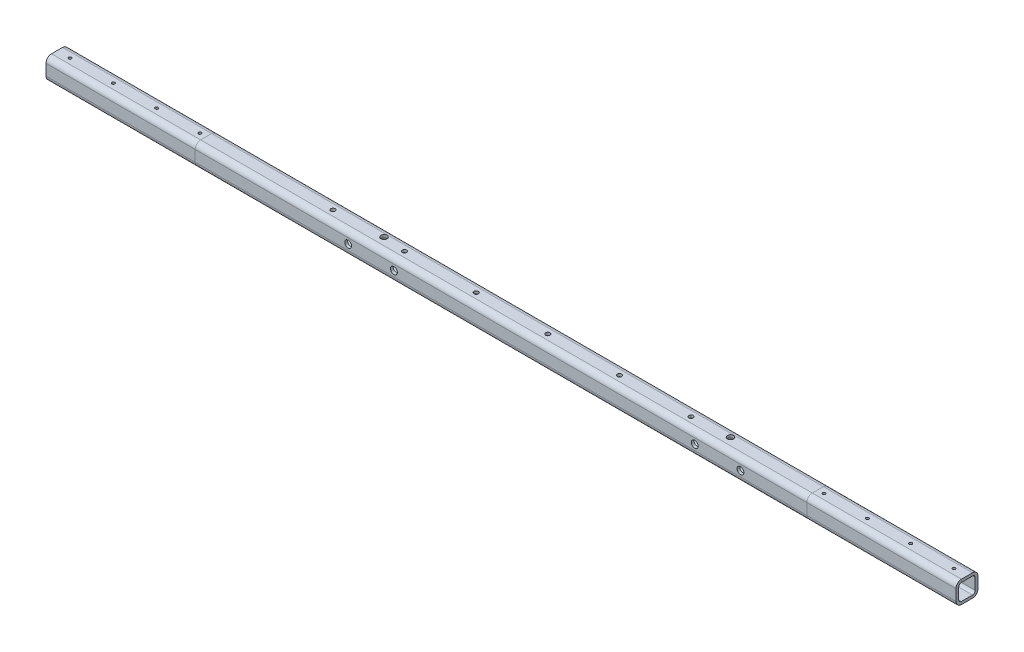
from build123d import *

# Parameters (mm, degrees)
MIEMBRO_ESTRUCTURAL1_DEPTH             = 1412
TALADRO_DE_MARGEN_PARA_M61_D           = 6.6
TALADRO_DE_MARGEN_PARA_M61_DEPTH       = 6.35
TALADRO_DE_MARGEN_PARA_3_81_D          = 10.0838
TALADRO_DE_MARGEN_PARA_3_81_DEPTH      = 6.35
MIEMBRO_ESTRUCTURAL2_DEPTH             = 344.4
MIEMBRO_ESTRUCTURAL2_2_DEPTH           = 344.4
CROQUIS9_W                             = 3.3782
CROQUIS9_H                             = 6.35
TALADRO_DE_MARGEN_PARA_1_41_AT_2_COUNT = 2
TALADRO_DE_MARGEN_PARA_1_41_AT_2_PITCH = 45
TALADRO_DE_MARGEN_PARA_1_41_AT_3_COUNT = 2
TALADRO_DE_MARGEN_PARA_1_41_AT_3_PITCH = 90
CROQUIS11_W                            = 3.3782
CROQUIS11_H                            = 6.351
TALADRO_DE_MARGEN_PARA_1_42_AT_2_COUNT = 2
TALADRO_DE_MARGEN_PARA_1_42_AT_2_PITCH = 100
TALADRO_DE_MARGEN_PARA_1_42_AT_3_COUNT = 2
TALADRO_DE_MARGEN_PARA_1_42_AT_3_PITCH = 200
TALADRO_DE_MARGEN_PARA_1_42_AT_4_COUNT = 2
TALADRO_DE_MARGEN_PARA_1_42_AT_4_PITCH = 300
TALADRO_DE_MARGEN_PARA_1_42_AT_5_COUNT = 2
TALADRO_DE_MARGEN_PARA_1_42_AT_5_PITCH = 1740.8
TALADRO_DE_MARGEN_PARA_1_42_AT_6_COUNT = 2
TALADRO_DE_MARGEN_PARA_1_42_AT_6_PITCH = 1840.8
TALADRO_DE_MARGEN_PARA_1_42_AT_7_COUNT = 2
TALADRO_DE_MARGEN_PARA_1_42_AT_7_PITCH = 1940.8
TALADRO_DE_MARGEN_PARA_1_42_AT_8_COUNT = 2
TALADRO_DE_MARGEN_PARA_1_42_AT_8_PITCH = 2040.8
CUT_EXTRUDE1_REACH                     = 1136.188
SKETCH12_R                             = 7.9375
CUT_EXTRUDE2_REACH                     = 1136.188


with BuildPart() as part:
    # Sketch1 → Miembro estructural1 (new body)
    with BuildSketch(Plane.YZ.offset(-623.635182539)):
        with BuildLine():
            Line((-12.7, -25.4), (12.7, -25.4))
            ThreePointArc((12.7, -25.4), (21.680256121, -21.680256121), (25.4, -12.7))
            Line((25.4, -12.7), (25.4, 12.7))
            ThreePointArc((25.4, 12.7), (21.680256121, 21.680256121), (12.7, 25.4))
            Line((12.7, 25.4), (-12.7, 25.4))
            ThreePointArc((-12.7, 25.4), (-21.680256121, 21.680256121), (-25.4, 12.7))
            Line((-25.4, 12.7), (-25.4, -12.7))
            ThreePointArc((-25.4, -12.7), (-21.680256121, -21.680256121), (-12.7, -25.4))
        make_face()
        with BuildLine():
            Line((-12.7, -19.05), (12.7, -19.05))
            ThreePointArc((12.7, -19.05), (17.190128061, -17.190128061), (19.05, -12.7))
            Line((19.05, -12.7), (19.05, 12.7))
            ThreePointArc((19.05, 12.7), (17.190128061, 17.190128061), (12.7, 19.05))
            Line((12.7, 19.05), (-12.7, 19.05))
            ThreePointArc((-12.7, 19.05), (-17.190128061, 17.190128061), (-19.05, 12.7))
            Line((-19.05, 12.7), (-19.05, -12.7))
            ThreePointArc((-19.05, -12.7), (-17.190128061, -17.190128061), (-12.7, -19.05))
        make_face(mode=Mode.SUBTRACT)
    extrude(amount=MIEMBRO_ESTRUCTURAL1_DEPTH)

    # Taladro de margen para M61
    with Locations(Plane(origin=(0, -25.4, 0), x_dir=(-1, 0, 0), z_dir=(0, -1, 0))):
        with Locations((-152.364817461, 0), (-212.364817461, 0)):
            Hole(TALADRO_DE_MARGEN_PARA_M61_D / 2, depth=TALADRO_DE_MARGEN_PARA_M61_DEPTH)

    # Taladro de margen para 3/81
    with Locations(Plane(origin=(0, 25.4, 0), x_dir=(1, 0, 0), z_dir=(0, 1, 0))):
        with Locations((-331.060182539, 0), (-165.690182539, 0), (-0.320182539, 0), (165.049817461, 0), (330.419817461, 0), (495.789817461, 0)):
            Hole(TALADRO_DE_MARGEN_PARA_3_81_D / 2, depth=TALADRO_DE_MARGEN_PARA_3_81_DEPTH)

    # Croquis9 → Taladro de margen para 1/41 (revolve, cut)
    with BuildSketch(Plane(origin=(137.364817461, -25.4, 0), x_dir=(0, 0, -1), z_dir=(1, 0, 0))):
        with Locations((1.6891, 3.175)):
            Rectangle(CROQUIS9_W, CROQUIS9_H)
    taladro_de_margen_para_1_41 = revolve(axis=Axis((137.364817461, -31.75, 0), (0, 1, 0)), mode=Mode.SUBTRACT)

    # Taladro de margen para 1/41 at 2: Taladro de margen para 1/41 ×2
    with Locations(*[(i * TALADRO_DE_MARGEN_PARA_1_41_AT_2_PITCH, 0, 0) for i in range(1, TALADRO_DE_MARGEN_PARA_1_41_AT_2_COUNT)]):
        add(taladro_de_margen_para_1_41, mode=Mode.SUBTRACT)

    # Taladro de margen para 1/41 at 3: Taladro de margen para 1/41 ×2
    with Locations(*[(i * TALADRO_DE_MARGEN_PARA_1_41_AT_3_PITCH, 0, 0) for i in range(1, TALADRO_DE_MARGEN_PARA_1_41_AT_3_COUNT)]):
        add(taladro_de_margen_para_1_41, mode=Mode.SUBTRACT)

    # Cut-Extrude1: up to this face of the body (flat: up to its plane)
    cut_extrude1_end = Plane(part.part.faces().sort_by_distance((82.364817461, 0, 25.4))[0])
    # Sketch12 → Cut-Extrude1 (cut, up to the picked face)
    with BuildSketch(Plane(origin=(0, 0, -25.4), x_dir=(-1, 0, 0), z_dir=(0, 0, -1)), mode=Mode.PRIVATE) as cut_extrude1_sk1:
        with Locations((270.418972539, 0)):
            Circle(SKETCH12_R)
    cut_extrude1_tool1 = split(extrude(cut_extrude1_sk1.sketch, amount=-CUT_EXTRUDE1_REACH, mode=Mode.PRIVATE), bisect_by=cut_extrude1_end, keep=Keep.BOTH, mode=Mode.PRIVATE)
    # Sketch12 → Cut-Extrude1 (cut, up to the picked face)
    with BuildSketch(Plane(origin=(0, 0, -25.4), x_dir=(-1, 0, 0), z_dir=(0, 0, -1)), mode=Mode.PRIVATE) as cut_extrude1_sk2:
        with Locations((164.851392539, 0)):
            Circle(SKETCH12_R)
    cut_extrude1_tool2 = split(extrude(cut_extrude1_sk2.sketch, amount=-CUT_EXTRUDE1_REACH, mode=Mode.PRIVATE), bisect_by=cut_extrude1_end, keep=Keep.BOTH, mode=Mode.PRIVATE)
    # Sketch12 → Cut-Extrude1 (cut, up to the picked face)
    with BuildSketch(Plane(origin=(0, 0, -25.4), x_dir=(-1, 0, 0), z_dir=(0, 0, -1)), mode=Mode.PRIVATE) as cut_extrude1_sk3:
        with Locations((-529.581027461, 0)):
            Circle(SKETCH12_R)
    cut_extrude1_tool3 = split(extrude(cut_extrude1_sk3.sketch, amount=-CUT_EXTRUDE1_REACH, mode=Mode.PRIVATE), bisect_by=cut_extrude1_end, keep=Keep.BOTH, mode=Mode.PRIVATE)
    # Sketch12 → Cut-Extrude1 (cut, up to the picked face)
    with BuildSketch(Plane(origin=(0, 0, -25.4), x_dir=(-1, 0, 0), z_dir=(0, 0, -1)), mode=Mode.PRIVATE) as cut_extrude1_sk4:
        with Locations((-635.148607461, 0)):
            Circle(SKETCH12_R)
    cut_extrude1_tool4 = split(extrude(cut_extrude1_sk4.sketch, amount=-CUT_EXTRUDE1_REACH, mode=Mode.PRIVATE), bisect_by=cut_extrude1_end, keep=Keep.BOTH, mode=Mode.PRIVATE)
    add(cut_extrude1_tool1.solids().sort_by(Axis((-270.418973, 0, -25.4), (0, 0, 1)))[0], mode=Mode.SUBTRACT)
    add(cut_extrude1_tool2.solids().sort_by(Axis((-164.851393, 0, -25.4), (0, 0, 1)))[0], mode=Mode.SUBTRACT)
    add(cut_extrude1_tool3.solids().sort_by(Axis((529.581027, 0, -25.4), (0, 0, 1)))[0], mode=Mode.SUBTRACT)
    add(cut_extrude1_tool4.solids().sort_by(Axis((635.148607, 0, -25.4), (0, 0, 1)))[0], mode=Mode.SUBTRACT)

    # Cut-Extrude2: up to this face of the body (flat: up to its plane)
    cut_extrude2_end = Plane(part.part.faces().sort_by_distance((81.871717159, -25.4, 0))[0])
    # Sketch13 → Cut-Extrude2 (cut, up to the picked face)
    with BuildSketch(Plane(origin=(0, 25.4, 0), x_dir=(-1, 0, 0), z_dir=(0, 1, 0)), mode=Mode.PRIVATE) as cut_extrude2_sk1:
        with BuildLine():
            ThreePointArc((-575.249838558, -4.6), (-582.249838558, 2.4), (-589.249838558, -4.6))
            ThreePointArc((-589.249838558, -4.6), (-582.249838558, -11.6), (-575.249838558, -4.6))
        make_face()
    cut_extrude2_tool1 = split(extrude(cut_extrude2_sk1.sketch, amount=-CUT_EXTRUDE2_REACH, mode=Mode.PRIVATE), bisect_by=cut_extrude2_end, keep=Keep.BOTH, mode=Mode.PRIVATE)
    # Sketch13 → Cut-Extrude2 (cut, up to the picked face)
    with BuildSketch(Plane(origin=(0, 25.4, 0), x_dir=(-1, 0, 0), z_dir=(0, 1, 0)), mode=Mode.PRIVATE) as cut_extrude2_sk2:
        with BuildLine():
            ThreePointArc((210.750161442, -4.6), (217.750161442, -11.6), (224.750161442, -4.6))
            ThreePointArc((224.750161442, -4.6), (217.750161442, 2.4), (210.750161442, -4.6))
        make_face()
    cut_extrude2_tool2 = split(extrude(cut_extrude2_sk2.sketch, amount=-CUT_EXTRUDE2_REACH, mode=Mode.PRIVATE), bisect_by=cut_extrude2_end, keep=Keep.BOTH, mode=Mode.PRIVATE)
    add(cut_extrude2_tool1.solids().sort_by(Axis((582.249839, 25.4, -4.6), (0, -1, 0)))[0], mode=Mode.SUBTRACT)
    add(cut_extrude2_tool2.solids().sort_by(Axis((-217.750161, 25.4, -4.6), (0, -1, 0)))[0], mode=Mode.SUBTRACT)


with BuildPart() as body_2:
    # Sketch11 → Miembro estructural2 (new body)
    with BuildSketch(Plane(origin=(-623.635182539, 0, 0), x_dir=(0, -1, 0), z_dir=(-1, 0, 0))):
        with BuildLine():
            Line((-12.7, -25.4), (12.7, -25.4))
            ThreePointArc((12.7, -25.4), (21.680256121, -21.680256121), (25.4, -12.7))
            Line((25.4, -12.7), (25.4, 12.7))
            ThreePointArc((25.4, 12.7), (21.680256121, 21.680256121), (12.7, 25.4))
            Line((12.7, 25.4), (-12.7, 25.4))
            ThreePointArc((-12.7, 25.4), (-21.680256121, 21.680256121), (-25.4, 12.7))
            Line((-25.4, 12.7), (-25.4, -12.7))
            ThreePointArc((-25.4, -12.7), (-21.680256121, -21.680256121), (-12.7, -25.4))
        make_face()
        with BuildLine():
            Line((-12.7, -19.05), (12.7, -19.05))
            ThreePointArc((12.7, -19.05), (17.190128061, -17.190128061), (19.05, -12.7))
            Line((19.05, -12.7), (19.05, 12.7))
            ThreePointArc((19.05, 12.7), (17.190128061, 17.190128061), (12.7, 19.05))
            Line((12.7, 19.05), (-12.7, 19.05))
            ThreePointArc((-12.7, 19.05), (-17.190128061, 17.190128061), (-19.05, 12.7))
            Line((-19.05, 12.7), (-19.05, -12.7))
            ThreePointArc((-19.05, -12.7), (-17.190128061, -17.190128061), (-12.7, -19.05))
        make_face(mode=Mode.SUBTRACT)
    extrude(amount=MIEMBRO_ESTRUCTURAL2_DEPTH)


with BuildPart() as body_3:
    # Sketch11 on segment 2 (carried to segment 2) → Miembro estructural2 2 (new body)
    with BuildSketch(Plane(origin=(1132.764817461, 0, 0), x_dir=(0, -1, 0), z_dir=(-1, 0, 0))):
        with BuildLine():
            Line((-12.7, -25.4), (12.7, -25.4))
            ThreePointArc((12.7, -25.4), (21.680256121, -21.680256121), (25.4, -12.7))
            Line((25.4, -12.7), (25.4, 12.7))
            ThreePointArc((25.4, 12.7), (21.680256121, 21.680256121), (12.7, 25.4))
            Line((12.7, 25.4), (-12.7, 25.4))
            ThreePointArc((-12.7, 25.4), (-21.680256121, 21.680256121), (-25.4, 12.7))
            Line((-25.4, 12.7), (-25.4, -12.7))
            ThreePointArc((-25.4, -12.7), (-21.680256121, -21.680256121), (-12.7, -25.4))
        make_face()
        with BuildLine():
            Line((-12.7, -19.05), (12.7, -19.05))
            ThreePointArc((12.7, -19.05), (17.190128061, -17.190128061), (19.05, -12.7))
            Line((19.05, -12.7), (19.05, 12.7))
            ThreePointArc((19.05, 12.7), (17.190128061, 17.190128061), (12.7, 19.05))
            Line((12.7, 19.05), (-12.7, 19.05))
            ThreePointArc((-12.7, 19.05), (-17.190128061, 17.190128061), (-19.05, 12.7))
            Line((-19.05, 12.7), (-19.05, -12.7))
            ThreePointArc((-19.05, -12.7), (-17.190128061, -17.190128061), (-12.7, -19.05))
        make_face(mode=Mode.SUBTRACT)
    extrude(amount=MIEMBRO_ESTRUCTURAL2_2_DEPTH)

    # Croquis11 → Taladro de margen para 1/42 (revolve, cut)
    with BuildSketch(Plane(origin=(1102.764817461, 25.4, 0), x_dir=(0, 0, 1), z_dir=(1, 0, 0))):
        with Locations((1.6891, 3.1755)):
            Rectangle(CROQUIS11_W, CROQUIS11_H)
    taladro_de_margen_para_1_42 = revolve(axis=Axis((1102.764817461, 31.75, 0), (0, -1, 0)), mode=Mode.SUBTRACT)

    # Taladro de margen para 1/42 at 2: Taladro de margen para 1/42 ×2
    with Locations(*[(-i * TALADRO_DE_MARGEN_PARA_1_42_AT_2_PITCH, 0, 0) for i in range(1, TALADRO_DE_MARGEN_PARA_1_42_AT_2_COUNT)]):
        add(taladro_de_margen_para_1_42, mode=Mode.SUBTRACT)

    # Taladro de margen para 1/42 at 3: Taladro de margen para 1/42 ×2
    with Locations(*[(-i * TALADRO_DE_MARGEN_PARA_1_42_AT_3_PITCH, 0, 0) for i in range(1, TALADRO_DE_MARGEN_PARA_1_42_AT_3_COUNT)]):
        add(taladro_de_margen_para_1_42, mode=Mode.SUBTRACT)

    # Taladro de margen para 1/42 at 4: Taladro de margen para 1/42 ×2
    with Locations(*[(-i * TALADRO_DE_MARGEN_PARA_1_42_AT_4_PITCH, 0, 0) for i in range(1, TALADRO_DE_MARGEN_PARA_1_42_AT_4_COUNT)]):
        add(taladro_de_margen_para_1_42, mode=Mode.SUBTRACT)


with BuildPart() as body_2_1:
    add(body_2.part)

    # Taladro de margen para 1/42 at 5: Taladro de margen para 1/42 ×2
    with Locations(*[(-i * TALADRO_DE_MARGEN_PARA_1_42_AT_5_PITCH, 0, 0) for i in range(1, TALADRO_DE_MARGEN_PARA_1_42_AT_5_COUNT)]):
        add(taladro_de_margen_para_1_42, mode=Mode.SUBTRACT)

    # Taladro de margen para 1/42 at 6: Taladro de margen para 1/42 ×2
    with Locations(*[(-i * TALADRO_DE_MARGEN_PARA_1_42_AT_6_PITCH, 0, 0) for i in range(1, TALADRO_DE_MARGEN_PARA_1_42_AT_6_COUNT)]):
        add(taladro_de_margen_para_1_42, mode=Mode.SUBTRACT)

    # Taladro de margen para 1/42 at 7: Taladro de margen para 1/42 ×2
    with Locations(*[(-i * TALADRO_DE_MARGEN_PARA_1_42_AT_7_PITCH, 0, 0) for i in range(1, TALADRO_DE_MARGEN_PARA_1_42_AT_7_COUNT)]):
        add(taladro_de_margen_para_1_42, mode=Mode.SUBTRACT)

    # Taladro de margen para 1/42 at 8: Taladro de margen para 1/42 ×2
    with Locations(*[(-i * TALADRO_DE_MARGEN_PARA_1_42_AT_8_PITCH, 0, 0) for i in range(1, TALADRO_DE_MARGEN_PARA_1_42_AT_8_COUNT)]):
        add(taladro_de_margen_para_1_42, mode=Mode.SUBTRACT)


solid = Compound([part.part, body_3.part, body_2_1.part])
